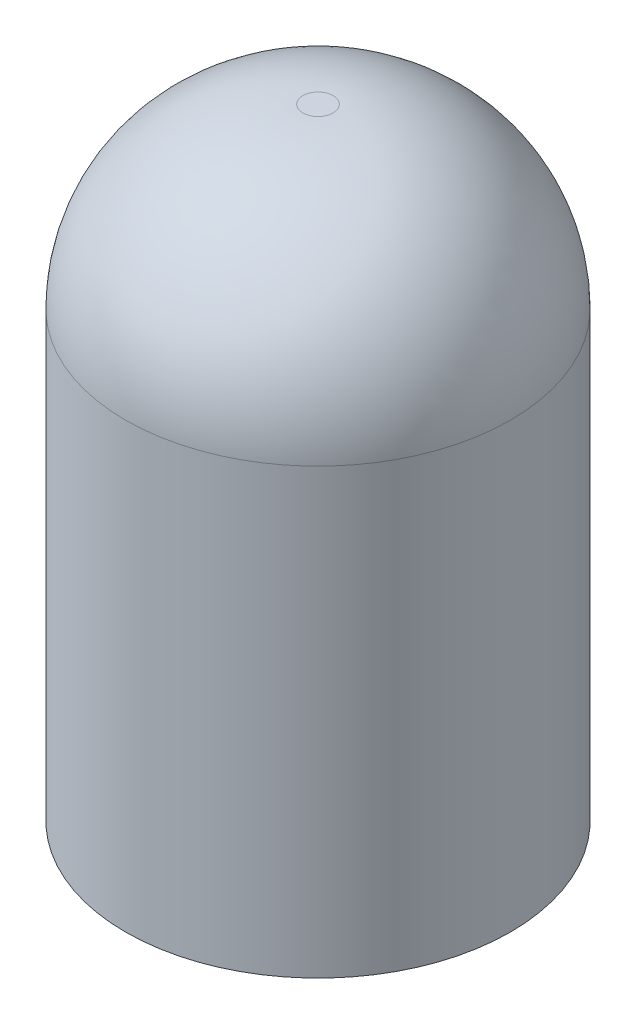
from build123d import *

# Parameters (mm, degrees)
SKETCH1_R           = 2.17
BOSS_EXTRUDE1_DEPTH = 7
FILLET3_R           = 2


with BuildPart() as part:
    # Sketch1 → Boss-Extrude1 (new body)
    with BuildSketch(Plane(origin=(0, 0, 0), x_dir=(1, 0, 0), z_dir=(0, 1, 0))):
        with Locations(Location((0, 0, 0), (0, 0, 270))):
            Circle(SKETCH1_R)
    extrude(amount=BOSS_EXTRUDE1_DEPTH)

    # Fillet3
    fillet3_edges = [part.edges().sort_by_distance(p)[0] for p in [
        (0, 7, -2.17),
    ]]
    fillet(fillet3_edges, radius=FILLET3_R)


solid = part.part
